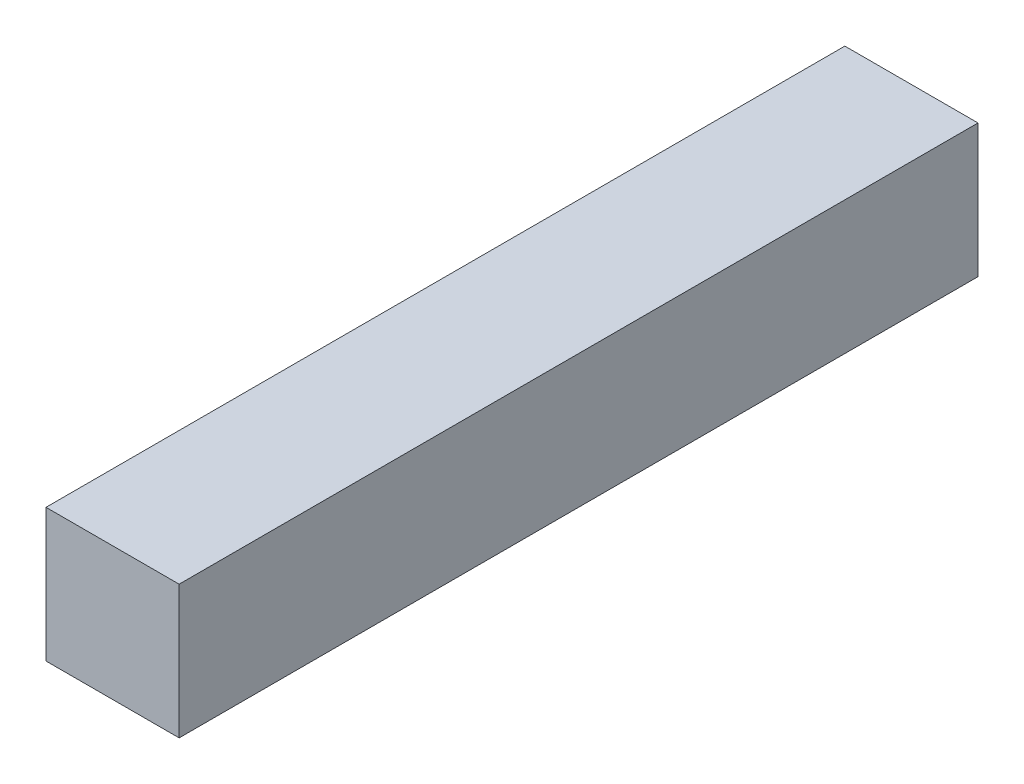
from build123d import *

# Parameters (mm, degrees)
SKETCH_1_W      = 10
SKETCH_1_H      = 10
EXTRUDE_1_DEPTH = 60


with BuildPart() as part:
    # 草图1 → 凸台-拉伸1 (new body)
    with BuildSketch(Plane.XY):
        Rectangle(SKETCH_1_W, SKETCH_1_H)
    extrude(amount=EXTRUDE_1_DEPTH)


solid = part.part
